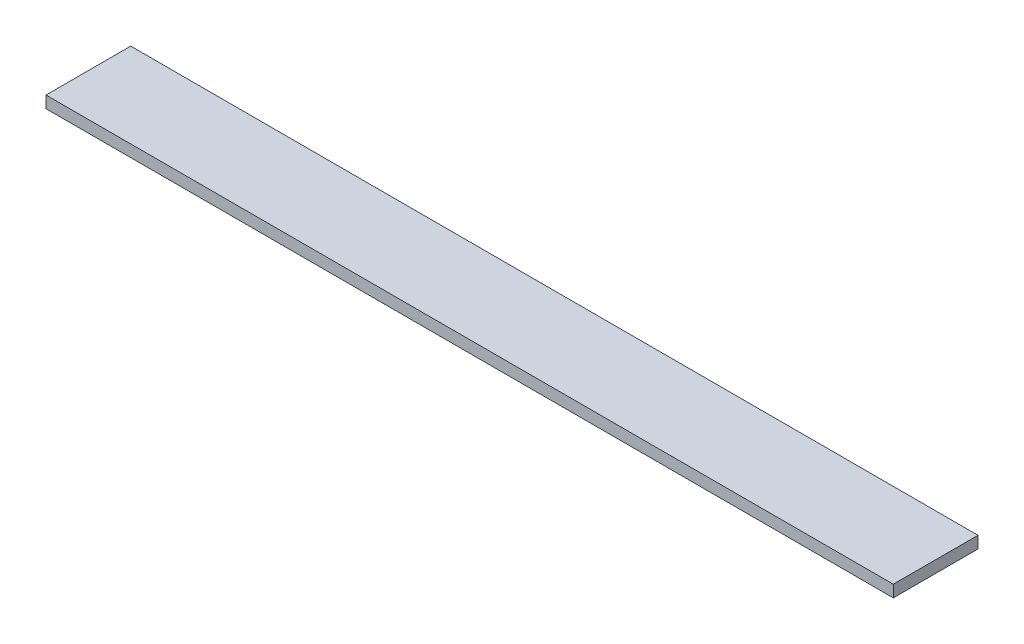
from build123d import *

# Parameters (mm, degrees)
SKETCH1_W           = 50
SKETCH1_H           = 5
BOSS_EXTRUDE1_DEPTH = 0.7


with BuildPart() as part:
    # Sketch1 → Boss-Extrude1 (new body)
    with BuildSketch(Plane(origin=(0, 0, 0), x_dir=(1, 0, 0), z_dir=(0, 1, 0))):
        Rectangle(SKETCH1_W, SKETCH1_H)
    extrude(amount=BOSS_EXTRUDE1_DEPTH)


solid = part.part
